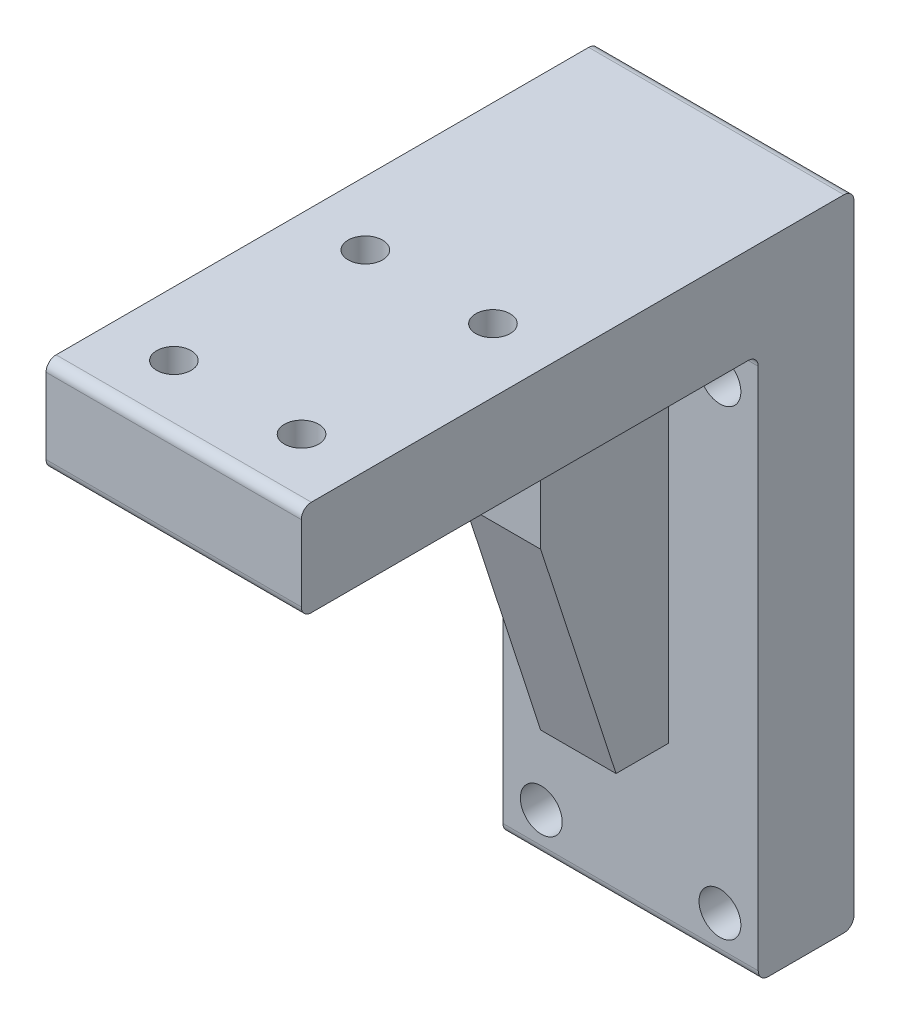
from build123d import *

# Parameters (mm, degrees)
SKETCH1_W           = 50.8
SKETCH1_H           = 127.254
SKETCH1_R           = 4.1656
BOSS_EXTRUDE1_DEPTH = 19.05
SKETCH1_3_W         = 50.8
SKETCH1_3_H         = 19.05
BOSS_EXTRUDE2_DEPTH = 110
SKETCH2_R           = 3.425
CUT_EXTRUDE1_DEPTH  = 176.710615832
FILLET1_R           = 2
SKETCH2_4_W         = 15
SKETCH2_4_H         = 25.4
BOSS_EXTRUDE3_DEPTH = 95
CHAMFER1_SIZE       = 15
CHAMFER1_SIZE2      = 46.165253058


with BuildPart() as part:
    # Sketch1 → Boss-Extrude1 (new body)
    with BuildSketch(Plane.XY):
        with Locations((25.4, -44.577)):
            Rectangle(SKETCH1_W, SKETCH1_H)
        with Locations((43.18, -8.128)):
            Circle(SKETCH1_R, mode=Mode.SUBTRACT)
        with Locations((7.62, -100.076)):
            Circle(SKETCH1_R, mode=Mode.SUBTRACT)
        with Locations((43.18, -100.076)):
            Circle(SKETCH1_R, mode=Mode.SUBTRACT)
        with Locations((7.62, -8.128)):
            Circle(SKETCH1_R, mode=Mode.SUBTRACT)
    extrude(amount=BOSS_EXTRUDE1_DEPTH)

    # Sketch1<3> → Boss-Extrude2 (add)
    with BuildSketch(Plane.XY):
        with Locations((25.4, 9.525)):
            Rectangle(SKETCH1_3_W, SKETCH1_3_H)
    extrude(amount=BOSS_EXTRUDE2_DEPTH)

    # Sketch2 → Cut-Extrude1 (cut, through all)
    with BuildSketch(Plane(origin=(0, 19.05, 0), x_dir=(1, 0, 0), z_dir=(0, 1, 0))):
        with Locations((12.7, -97.25)):
            Circle(SKETCH2_R)
        with Locations((38.1, -97.25)):
            Circle(SKETCH2_R)
        with Locations((12.7, -59.15)):
            Circle(SKETCH2_R)
        with Locations((38.1, -59.15)):
            Circle(SKETCH2_R)
    extrude(amount=-CUT_EXTRUDE1_DEPTH, mode=Mode.SUBTRACT)

    # Fillet1
    fillet1_edges = [part.edges().sort_by_distance(p)[0] for p in [
        (25.4, 19.05, 0),
        (25.4, 0, 110),
        (25.4, 19.05, 110),
        (25.4, -108.204, 19.05),
        (25.4, -108.204, 0),
        (25.4, 0, 19.05),
    ]]
    fillet(fillet1_edges, radius=FILLET1_R)

    # Sketch2<4> → Boss-Extrude3 (add)
    with BuildSketch(Plane(origin=(0, 19.05, 0), x_dir=(1, 0, 0), z_dir=(0, 1, 0))):
        with Locations((25.4, -31.75)):
            Rectangle(SKETCH2_4_W, SKETCH2_4_H)
    extrude(amount=-BOSS_EXTRUDE3_DEPTH)

    # Chamfer1
    chamfer1_edges = [part.edges().sort_by_distance(p)[0] for p in [
        (25.4, -75.95, 44.45),
    ]]
    chamfer1_side = [part.faces().sort_by_distance(p)[0] for p in [
        (25.4, -75.95, 31.75),
    ]]
    chamfer(chamfer1_edges, length=CHAMFER1_SIZE, length2=CHAMFER1_SIZE2, reference=chamfer1_side[0])


solid = part.part
